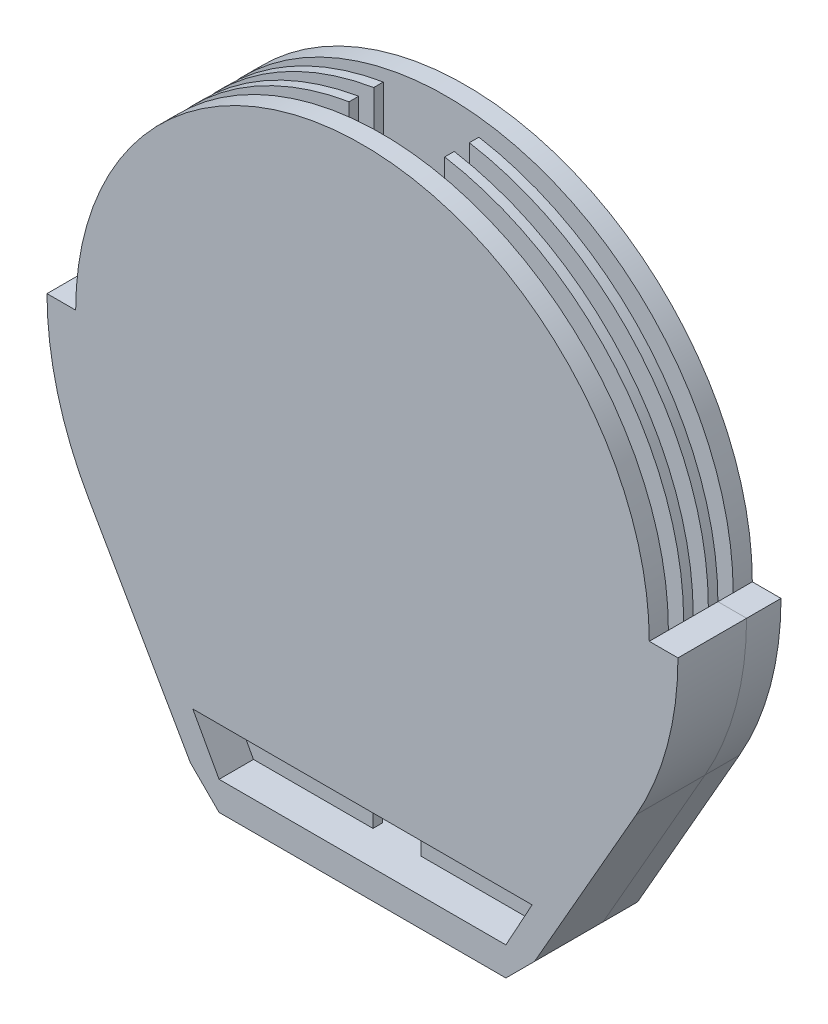
from build123d import *

# Parameters (mm, degrees)
RESSALTO_EXTRUS_O3_DEPTH = 1
RESSALTO_EXTRUS_O4_START = -3.58
RESSALTO_EXTRUS_O4_DEPTH = 3.58
RESSALTO_EXTRUS_O5_DEPTH = 1
RESSALTO_EXTRUS_O6_DEPTH = 1.6
RESSALTO_EXTRUS_O7_DEPTH = 1.6
ESBO_O9_W                = 10
ESBO_O9_H                = 12.857862002
CORTE_EXTRUS_O2_DEPTH    = 4
RESSALTO_EXTRUS_O8_DEPTH = 2
RESSALTO_EXTRUS_O9_START = 2
RESSALTO_EXTRUS_O9_DEPTH = 2


with BuildPart() as part:
    # Esboço1 → Ressalto-extrusão3 (new body)
    with BuildSketch(Plane.XY):
        with BuildLine():
            Line((5, -35), (15, -35))
            Line((15, -35), (26.292884648, -14.44590658))
            ThreePointArc((26.292884648, -14.44590658), (0, 30), (-26.292884648, -14.44590658))
            Line((-26.292884648, -14.44590658), (-15, -35))
            Line((-15, -35), (-5, -35))
            Line((-5, -35), (-2.5, -35))
            Line((-2.5, -35), (-2.5, -32.5))
            Line((-2.5, -32.5), (-2.5, -30))
            Line((-2.5, -30), (-5, -30))
            Line((-5, -30), (-12, -30))
            Line((-12, -30), (-21.889001071, -12.077732905))
            ThreePointArc((-21.889001071, -12.077732905), (0, 25), (21.889001071, -12.077732905))
            Line((21.889001071, -12.077732905), (12, -30))
            Line((12, -30), (5, -30))
            Line((5, -30), (2.5, -30))
            Line((2.5, -30), (2.5, -32.5))
            Line((2.5, -32.5), (2.5, -35))
            Line((2.5, -35), (5, -35))
        make_face()
    extrude(amount=RESSALTO_EXTRUS_O3_DEPTH)

    # Esboço2 → Ressalto-extrusão4 (add)
    with BuildSketch(Plane.XY.offset(1).offset(RESSALTO_EXTRUS_O4_START)):
        Polygon((-2.5, -35), (-15, -35), (-15, -38), (15, -38), (15, -35), (2.5, -35), align=None)
        Polygon((18, -35), (15, -38), (15, -35), align=None)
        with BuildLine():
            Line((33, 0), (30, 0))
            ThreePointArc((30, 0), (29.058445755, -7.45699204), (26.292884648, -14.44590658))
            Line((26.292884648, -14.44590658), (15, -35))
            Line((15, -35), (18, -35))
            Line((18, -35), (28.646862641, -16.381613499))
            ThreePointArc((28.646862641, -16.381613499), (31.893153397, -8.47506734), (33, 0))
        make_face()
        Polygon((-15, -35), (-18, -35), (-15, -38), align=None)
        with BuildLine():
            ThreePointArc((-26.292884648, -14.44590658), (-29.058445755, -7.45699204), (-30, 0))
            Line((-30, 0), (-33, 0))
            ThreePointArc((-33, 0), (-31.893153397, -8.47506734), (-28.646862641, -16.381613499))
            Line((-28.646862641, -16.381613499), (-18, -35))
            Line((-18, -35), (-15, -35))
            Line((-15, -35), (-26.292884648, -14.44590658))
        make_face()
    extrude(amount=RESSALTO_EXTRUS_O4_DEPTH)

    # Esboço4 → Ressalto-extrusão5 (add)
    with BuildSketch(Plane(origin=(0, 0, -2.58), x_dir=(-1, 0, 0), z_dir=(0, 0, -1))):
        with BuildLine():
            Line((-15, -35), (-2.5, -35))
            Line((-2.5, -35), (-2.5, -30))
            Line((-2.5, -30), (-12, -30))
            Line((-12, -30), (-21.889001071, -12.077732905))
            ThreePointArc((-21.889001071, -12.077732905), (0, 25), (21.889001071, -12.077732905))
            Line((21.889001071, -12.077732905), (12, -30))
            Line((12, -30), (2.5, -30))
            Line((2.5, -30), (2.5, -35))
            Line((2.5, -35), (15, -35))
            Line((15, -35), (26.292884648, -14.44590658))
            ThreePointArc((26.292884648, -14.44590658), (0, 30), (-26.292884648, -14.44590658))
            Line((-26.292884648, -14.44590658), (-15, -35))
        make_face()
    extrude(amount=-RESSALTO_EXTRUS_O5_DEPTH)

    # Esboço5 → Ressalto-extrusão6 (add)
    with BuildSketch(Plane.XY.offset(1)):
        with BuildLine():
            Line((-15, -38), (-18, -35))
            Line((-18, -35), (-28.646862641, -16.381613499))
            ThreePointArc((-28.646862641, -16.381613499), (-31.893153397, -8.47506734), (-33, 0))
            Line((-33, 0), (-29.999999999, 0))
            ThreePointArc((-29.999999999, 0), (-29.058445755, -7.456992039), (-26.292884647, -14.445906578))
            Line((-26.292884647, -14.445906578), (-15, -35))
            Line((-15, -35), (-12.5, -35))
            Line((-12.5, -35), (0, -35))
            Line((0, -35), (12.5, -35))
            Line((12.5, -35), (14.999999999, -35))
            Line((14.999999999, -35), (26.292884647, -14.445906579))
            ThreePointArc((26.292884647, -14.445906579), (29.058445755, -7.45699204), (29.999999999, 0))
            Line((29.999999999, 0), (33, 0))
            ThreePointArc((33, 0), (31.893153397, -8.47506734), (28.646862641, -16.381613499))
            Line((28.646862641, -16.381613499), (18, -35))
            Line((18, -35), (15, -38))
            Line((15, -38), (-15, -38))
        make_face()
    extrude(amount=RESSALTO_EXTRUS_O6_DEPTH)

    # Esboço9 → Corte-extrusão2 (cut)
    with BuildSketch(Plane.XY.offset(1)):
        with Locations((0, 30)):
            Rectangle(ESBO_O9_W, ESBO_O9_H)
    extrude(amount=-CORTE_EXTRUS_O2_DEPTH, mode=Mode.SUBTRACT)

    # Esboço8 → Ressalto-extrusão8 (add)
    with BuildSketch(Plane.XY.offset(2.6)):
        with BuildLine():
            Line((-15, -38), (15, -38))
            Line((15, -38), (18, -35))
            Line((18, -35), (28.646862641, -16.381613499))
            ThreePointArc((28.646862641, -16.381613499), (31.893153397, -8.47506734), (33, 0))
            Line((33, 0), (30, 0))
            ThreePointArc((30, 0), (0, 30), (-30, 0))
            Line((-30, 0), (-33, 0))
            ThreePointArc((-33, 0), (-31.893153397, -8.47506734), (-28.646862641, -16.381613499))
            Line((-28.646862641, -16.381613499), (-18, -35))
            Line((-18, -35), (-15, -38))
        make_face()
        Polygon((-12, -30), (17.747113291, -30), (14.999999999, -35), (-15, -35), (-17.747113292, -30), align=None, mode=Mode.SUBTRACT)
    extrude(amount=RESSALTO_EXTRUS_O8_DEPTH)


with BuildPart() as body_2:
    # Esboço6 → Ressalto-extrusão7 (new body)
    with BuildSketch(Plane(origin=(0, 0, -2.58), x_dir=(-1, 0, 0), z_dir=(0, 0, -1))):
        with BuildLine():
            Line((-15, -38), (-18, -35))
            Line((-18, -35), (-28.646862641, -16.381613499))
            ThreePointArc((-28.646862641, -16.381613499), (-31.893153397, -8.47506734), (-33, 0))
            Line((-33, 0), (-30, 0))
            ThreePointArc((-30, 0), (-29.058445755, -7.45699204), (-26.292884648, -14.44590658))
            Line((-26.292884648, -14.44590658), (-15, -35))
            Line((-15, -35), (15, -35))
            Line((15, -35), (26.292884648, -14.44590658))
            ThreePointArc((26.292884648, -14.44590658), (29.058445755, -7.45699204), (30, 0))
            Line((30, 0), (33, 0))
            ThreePointArc((33, 0), (31.893153397, -8.47506734), (28.646862641, -16.381613499))
            Line((28.646862641, -16.381613499), (18, -35))
            Line((18, -35), (15, -38))
            Line((15, -38), (-15, -38))
        make_face()
    extrude(amount=RESSALTO_EXTRUS_O7_DEPTH)

    # Esboço11 → Ressalto-extrusão9 (add)
    with BuildSketch(Plane(origin=(0, 0, -4.18), x_dir=(-1, 0, 0), z_dir=(0, 0, -1)).offset(RESSALTO_EXTRUS_O9_START)):
        with BuildLine():
            Line((-15, -38), (15, -38))
            Line((15, -38), (18, -35))
            Line((18, -35), (28.646862641, -16.381613499))
            ThreePointArc((28.646862641, -16.381613499), (31.893153397, -8.47506734), (33, 0))
            Line((33, 0), (30, 0))
            ThreePointArc((30, 0), (0, 30), (-30, 0))
            Line((-30, 0), (-33, 0))
            ThreePointArc((-33, 0), (-31.893153397, -8.47506734), (-28.646862641, -16.381613499))
            Line((-28.646862641, -16.381613499), (-18, -35))
            Line((-18, -35), (-15, -38))
        make_face()
        Polygon((-15, -35), (15, -35), (17.747113292, -30), (-12, -30), (-17.747113292, -30), align=None, mode=Mode.SUBTRACT)
    extrude(amount=-RESSALTO_EXTRUS_O9_DEPTH)


solid = Compound([part.part, body_2.part])
